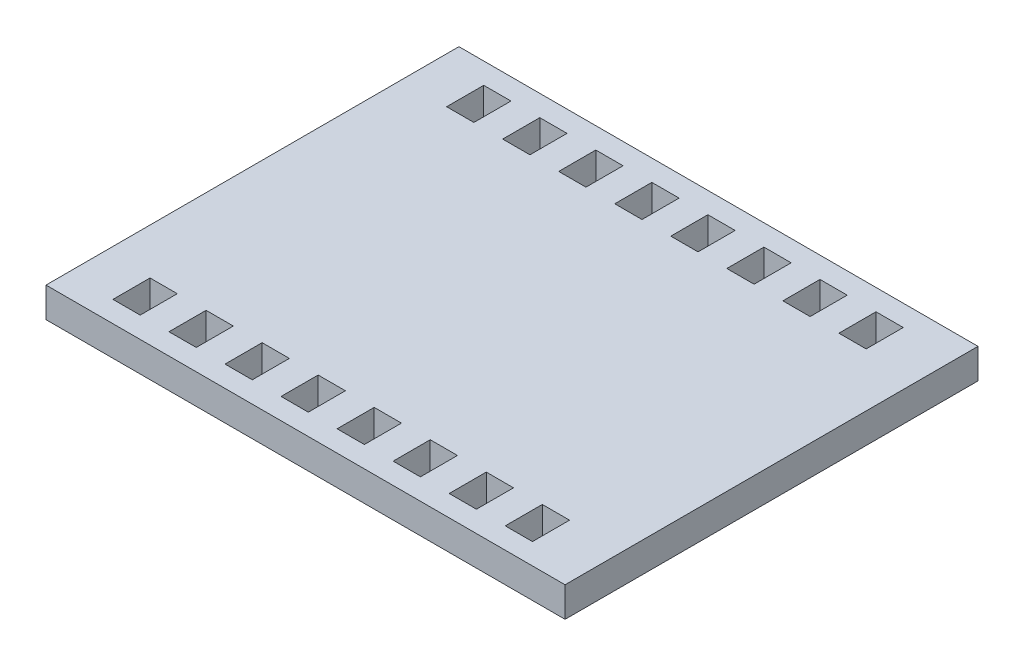
from build123d import *

# Parameters (mm, degrees)
SKETCH1_W           = 43.996114434
SKETCH1_H           = 35
SKETCH1_W_2         = 2.309524735
SKETCH1_H_2         = 3.144240455
BOSS_EXTRUDE1_DEPTH = 2.54


with BuildPart() as part:
    # Sketch1 → Boss-Extrude1 (new body)
    with BuildSketch(Plane(origin=(0, 0, 0), x_dir=(1, 0, 0), z_dir=(0, 1, 0))):
        with Locations((21.998057217, 17.5)):
            Rectangle(SKETCH1_W, SKETCH1_H)
        with Locations((9.792703118, 31.641798865)):
            Rectangle(SKETCH1_W_2, SKETCH1_H_2, mode=Mode.SUBTRACT)
        with Locations((5.042903118, 31.641798865)):
            Rectangle(SKETCH1_W_2, SKETCH1_H_2, mode=Mode.SUBTRACT)
        with Locations((14.542503118, 31.641798865)):
            Rectangle(SKETCH1_W_2, SKETCH1_H_2, mode=Mode.SUBTRACT)
        with Locations((19.292303117, 31.641798865)):
            Rectangle(SKETCH1_W_2, SKETCH1_H_2, mode=Mode.SUBTRACT)
        with Locations((24.042103117, 31.641798865)):
            Rectangle(SKETCH1_W_2, SKETCH1_H_2, mode=Mode.SUBTRACT)
        with Locations((28.791903117, 31.641798865)):
            Rectangle(SKETCH1_W_2, SKETCH1_H_2, mode=Mode.SUBTRACT)
        with Locations((33.541703118, 31.641798865)):
            Rectangle(SKETCH1_W_2, SKETCH1_H_2, mode=Mode.SUBTRACT)
        with Locations((38.291503117, 31.641798865)):
            Rectangle(SKETCH1_W_2, SKETCH1_H_2, mode=Mode.SUBTRACT)
        with Locations((38.291503117, 3.358201135)):
            Rectangle(SKETCH1_W_2, SKETCH1_H_2, mode=Mode.SUBTRACT)
        with Locations((33.541703118, 3.358201135)):
            Rectangle(SKETCH1_W_2, SKETCH1_H_2, mode=Mode.SUBTRACT)
        with Locations((28.791903117, 3.358201135)):
            Rectangle(SKETCH1_W_2, SKETCH1_H_2, mode=Mode.SUBTRACT)
        with Locations((24.042103117, 3.358201135)):
            Rectangle(SKETCH1_W_2, SKETCH1_H_2, mode=Mode.SUBTRACT)
        with Locations((19.292303117, 3.358201135)):
            Rectangle(SKETCH1_W_2, SKETCH1_H_2, mode=Mode.SUBTRACT)
        with Locations((14.542503118, 3.358201135)):
            Rectangle(SKETCH1_W_2, SKETCH1_H_2, mode=Mode.SUBTRACT)
        with Locations((9.792703118, 3.358201135)):
            Rectangle(SKETCH1_W_2, SKETCH1_H_2, mode=Mode.SUBTRACT)
        with Locations((5.042903118, 3.358201135)):
            Rectangle(SKETCH1_W_2, SKETCH1_H_2, mode=Mode.SUBTRACT)
    extrude(amount=BOSS_EXTRUDE1_DEPTH)


solid = part.part
